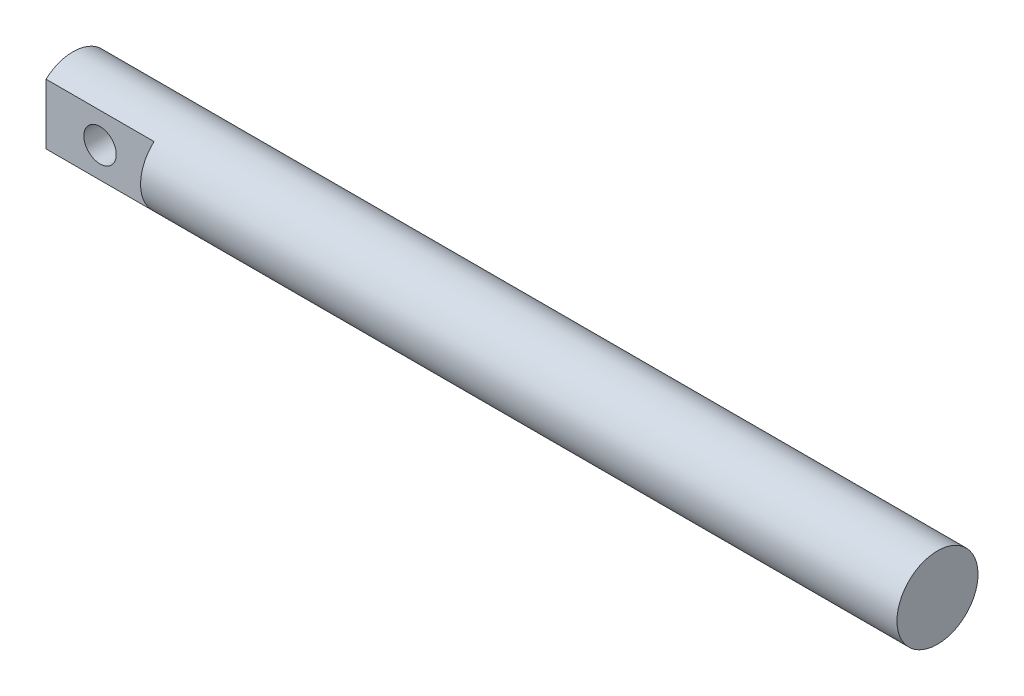
from build123d import *

# Parameters (mm, degrees)
SKETCH2_R               = 4.7625
BASE_EXTRUDE_DEPTH      = 101.6
CUT_EXTRUDE1_DEPTH      = 102.822997464
CUT_EXTRUDE1_DEPTH_BACK = 102.822997464
SKETCH5_R               = 1.905
CUT_EXTRUDE2_DEPTH      = 103.020808233


with BuildPart() as part:
    # Sketch2 → Base-Extrude (new body)
    with BuildSketch(Plane.ZY):
        Circle(SKETCH2_R)
    extrude(amount=BASE_EXTRUDE_DEPTH)

    # Sketch4 → Cut-Extrude1 (cut, two sides: drawn at the far end of the back side and taken through both)
    with BuildSketch(Plane(origin=(0, 0, 0), x_dir=(1, 0, 0), z_dir=(0, 1, 0)).offset(-CUT_EXTRUDE1_DEPTH_BACK)):
        Polygon((-109.22, 12.7), (-88.9, 12.7), (-88.9, 3.175), (-104.14, 3.175), (-104.14, -3.175), (-88.9, -3.175), (-88.9, -12.7), (-109.22, -12.7), align=None)
    extrude(amount=CUT_EXTRUDE1_DEPTH + CUT_EXTRUDE1_DEPTH_BACK, mode=Mode.SUBTRACT)

    # Sketch5 → Cut-Extrude2 (cut, through all)
    with BuildSketch(Plane.XY.offset(3.175)):
        with Locations((-95.25, 0)):
            Circle(SKETCH5_R)
    extrude(amount=-CUT_EXTRUDE2_DEPTH, mode=Mode.SUBTRACT)


solid = part.part
